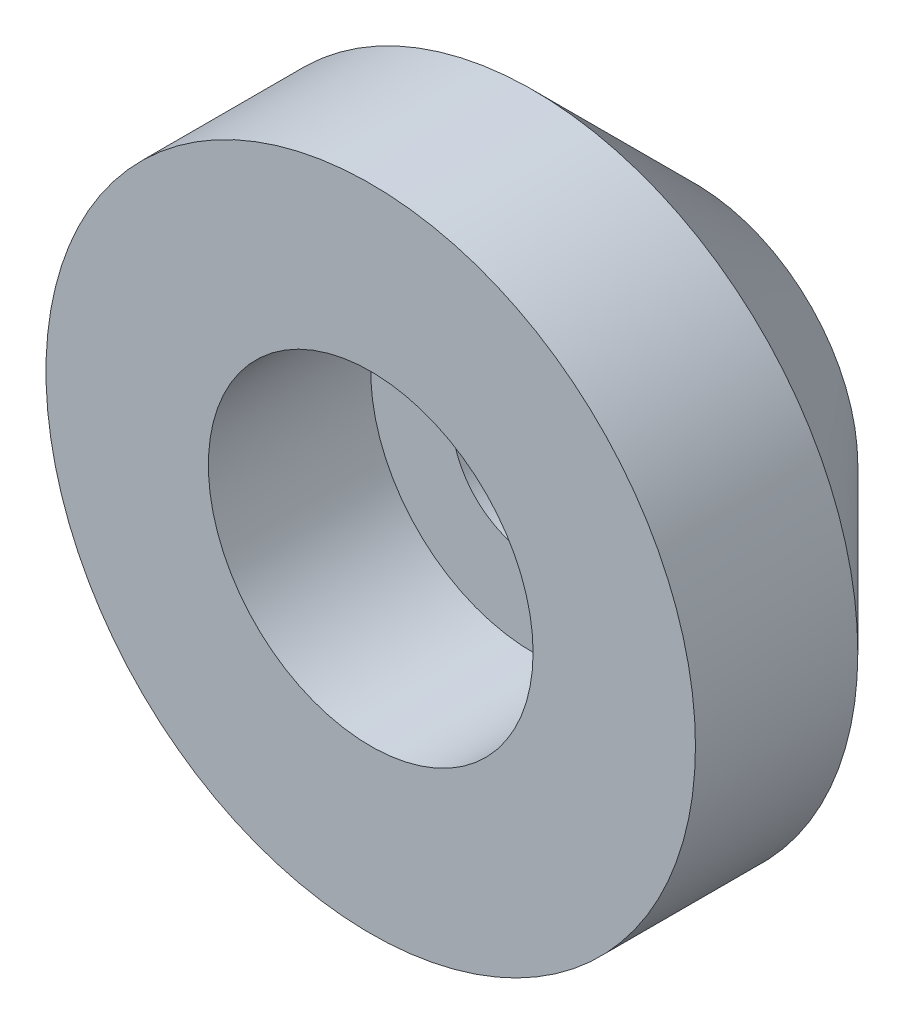
from build123d import *

# Parameters (mm, degrees)
SKETCH1_R           = 5
BOSS_EXTRUDE1_DEPTH = 5
SKETCH2_R           = 2.5
CUT_EXTRUDE1_DEPTH  = 2.5
SKETCH3_R           = 1.25
CUT_EXTRUDE2_DEPTH  = 9.660254038
CHAMFER1_SIZE       = 2.5


with BuildPart() as part:
    # Sketch1 → Boss-Extrude1 (new body)
    with BuildSketch(Plane.XY):
        Circle(SKETCH1_R)
    extrude(amount=BOSS_EXTRUDE1_DEPTH)

    # Sketch2 → Cut-Extrude1 (cut)
    with BuildSketch(Plane.XY.offset(5)):
        Circle(SKETCH2_R)
    extrude(amount=-CUT_EXTRUDE1_DEPTH, mode=Mode.SUBTRACT)

    # Sketch3 → Cut-Extrude2 (cut, through all)
    with BuildSketch(Plane(origin=(0, 0, 0), x_dir=(-1, 0, 0), z_dir=(0, 0, -1))):
        Circle(SKETCH3_R)
    extrude(amount=-CUT_EXTRUDE2_DEPTH, mode=Mode.SUBTRACT)

    # Chamfer1
    chamfer1_edges = [part.edges().sort_by_distance(p)[0] for p in [
        (-5, 0, 0),
    ]]
    chamfer(chamfer1_edges, length=CHAMFER1_SIZE)


solid = part.part
